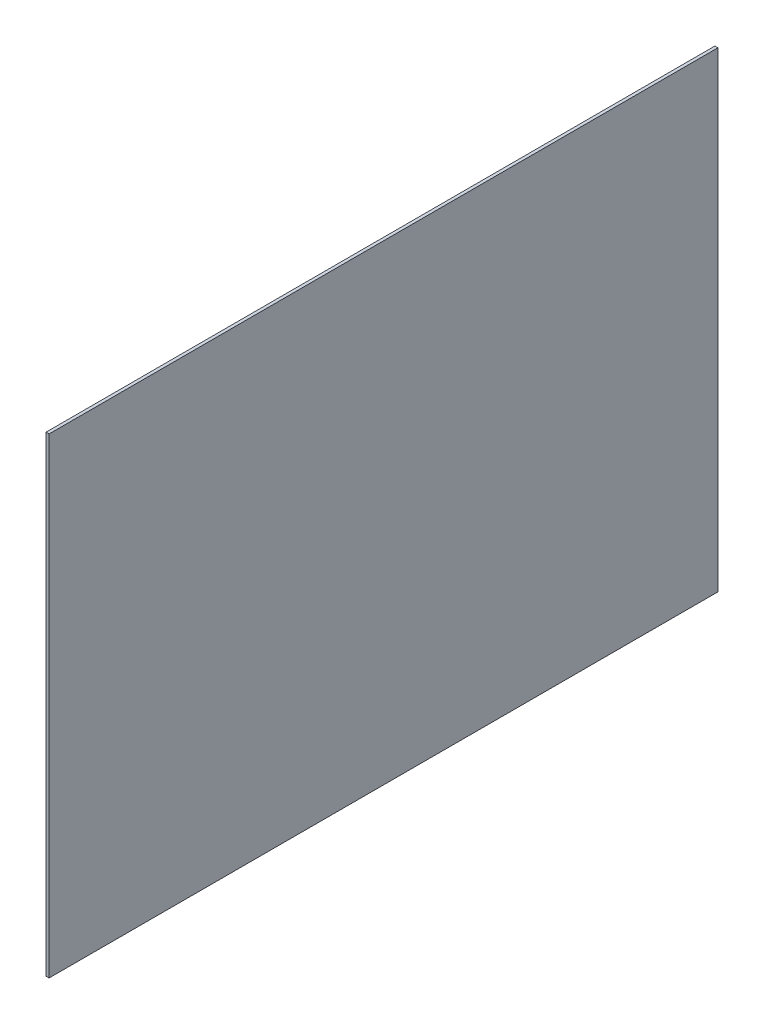
from build123d import *

# Parameters (mm, degrees)
ESQUISSE1_W        = 440
ESQUISSE1_H        = 310
BOSS_EXTRU_1_DEPTH = 2


with BuildPart() as part:
    # Esquisse1 → Boss.-Extru.1 (new body)
    with BuildSketch(Plane(origin=(0, 0, 0), x_dir=(0, 0, -1), z_dir=(1, 0, 0))):
        Rectangle(ESQUISSE1_W, ESQUISSE1_H)
    extrude(amount=BOSS_EXTRU_1_DEPTH)


solid = part.part
